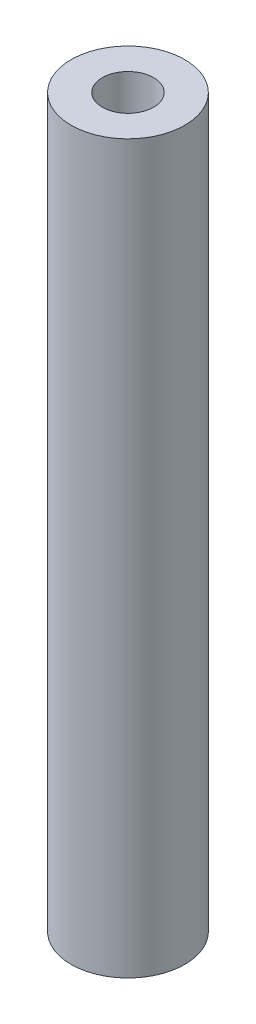
from build123d import *

# Parameters (mm, degrees)
SKETCH1_R                 = 3
BOSS_EXTRUDE1_DEPTH       = 38.34
F_6_32_TAPPED_HOLE1_D     = 2.7051
F_6_32_TAPPED_HOLE1_DEPTH = 7
F_6_32_TAPPED_HOLE1_TIP   = 0.81269403
F_6_32_TAPPED_HOLE2_D     = 2.7051
F_6_32_TAPPED_HOLE2_DEPTH = 7
F_6_32_TAPPED_HOLE2_TIP   = 0.81269403


with BuildPart() as part:
    # Sketch1 → Boss-Extrude1 (new body)
    with BuildSketch(Plane(origin=(0, 0, 0), x_dir=(1, 0, 0), z_dir=(0, 1, 0))):
        with Locations(Location((0, 0, 0), (0, 0, 270))):
            Circle(SKETCH1_R)
    extrude(amount=BOSS_EXTRUDE1_DEPTH)

    # #6-32 Tapped Hole1
    with Locations(Plane(origin=(0, 38.34, 0), x_dir=(1, 0, 0), z_dir=(0, 1, 0))):
        with Locations((0, 0)):
            Hole(F_6_32_TAPPED_HOLE1_D / 2, depth=F_6_32_TAPPED_HOLE1_DEPTH)
            with Locations((0, 0, -(F_6_32_TAPPED_HOLE1_DEPTH + F_6_32_TAPPED_HOLE1_TIP / 2))):  # 118° drill point
                Cone(0, F_6_32_TAPPED_HOLE1_D / 2, F_6_32_TAPPED_HOLE1_TIP, mode=Mode.SUBTRACT)

    # #6-32 Tapped Hole2
    with Locations(Plane(origin=(0, 0, 0), x_dir=(-1, 0, 0), z_dir=(0, -1, 0))):
        with Locations((0, 0)):
            Hole(F_6_32_TAPPED_HOLE2_D / 2, depth=F_6_32_TAPPED_HOLE2_DEPTH)
            with Locations((0, 0, -(F_6_32_TAPPED_HOLE2_DEPTH + F_6_32_TAPPED_HOLE2_TIP / 2))):  # 118° drill point
                Cone(0, F_6_32_TAPPED_HOLE2_D / 2, F_6_32_TAPPED_HOLE2_TIP, mode=Mode.SUBTRACT)


solid = part.part
